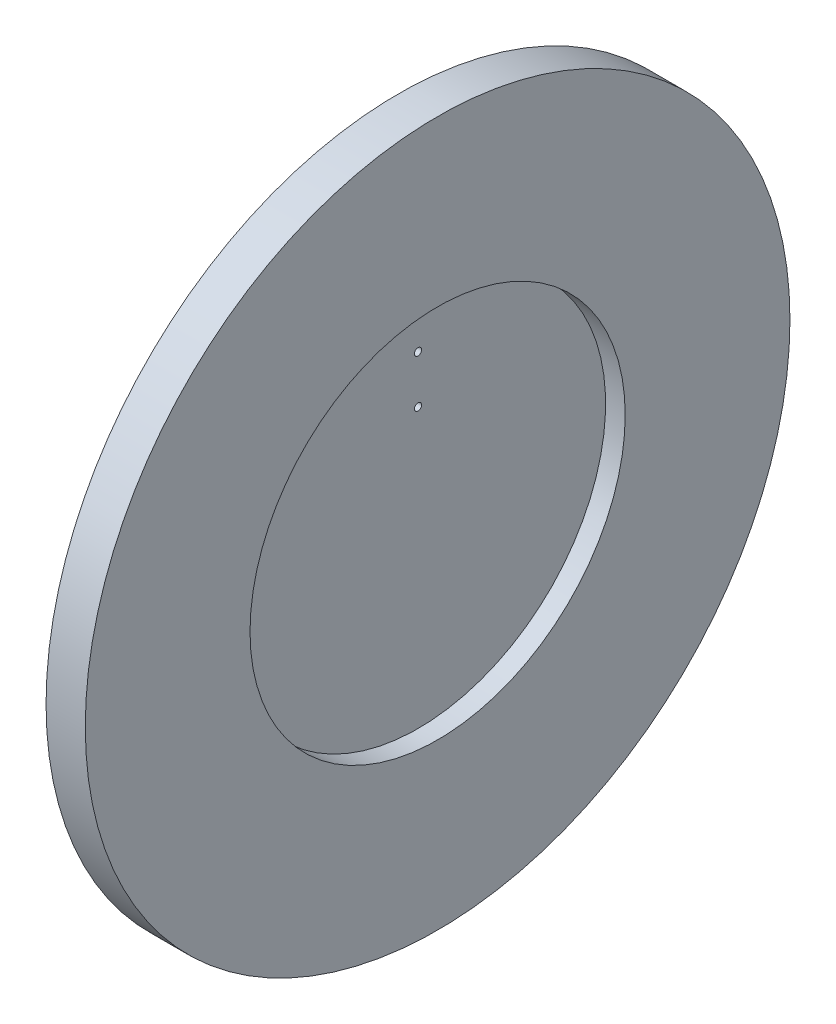
from build123d import *

# Parameters (mm, degrees)
SKETCH1_R                   = 89.825
SKETCH1_R_2                 = 47.825
BOSS_EXTRUDE1_DEPTH         = 10
SKETCH3_R                   = 47.825
TBH_IDK_DEPTH               = 5
EXTRUSION_START             = 5
SKETCH4_R                   = 47.825
EXTRUSION_TO_FUEL_MAN_DEPTH = 5
OX_DOWNCOMER_REACH          = 129.914
OX_PROFILE_R                = 0.914623685


with BuildPart() as part:
    # Sketch1 → Boss-Extrude1 (new body)
    with BuildSketch(Plane(origin=(0, 0, 0), x_dir=(0, 0, -1), z_dir=(1, 0, 0))):
        Circle(SKETCH1_R)
        Circle(SKETCH1_R_2, mode=Mode.SUBTRACT)
    extrude(amount=BOSS_EXTRUDE1_DEPTH)

    # Sketch3 → tbh idk (add)
    with BuildSketch(Plane.ZY):
        Circle(SKETCH3_R)
    extrude(amount=-TBH_IDK_DEPTH)

    # Sketch4 → Extrusion to Fuel Man (add)
    with BuildSketch(Plane.ZY.offset(EXTRUSION_START)):
        Circle(SKETCH4_R)
    extrude(amount=-EXTRUSION_TO_FUEL_MAN_DEPTH)

    # Ox Profile → Ox Downcomer (cut, up to next)
    with BuildSketch(Plane.ZY.offset(5), mode=Mode.PRIVATE) as ox_downcomer_sk1:
        with Locations((0, 23.192029736)):
            Circle(OX_PROFILE_R)
    ox_downcomer_tool1 = extrude(ox_downcomer_sk1.sketch, amount=-OX_DOWNCOMER_REACH, mode=Mode.PRIVATE) & part.part
    # Ox Profile → Ox Downcomer (cut, up to next)
    with BuildSketch(Plane.ZY.offset(5), mode=Mode.PRIVATE) as ox_downcomer_sk2:
        with Locations((0, 35.373170264)):
            Circle(OX_PROFILE_R)
    ox_downcomer_tool2 = extrude(ox_downcomer_sk2.sketch, amount=-OX_DOWNCOMER_REACH, mode=Mode.PRIVATE) & part.part
    add(ox_downcomer_tool1.solids().sort_by_distance((-5, 23.19203, 0))[0], mode=Mode.SUBTRACT)
    add(ox_downcomer_tool2.solids().sort_by_distance((-5, 35.37317, 0))[0], mode=Mode.SUBTRACT)


solid = part.part
